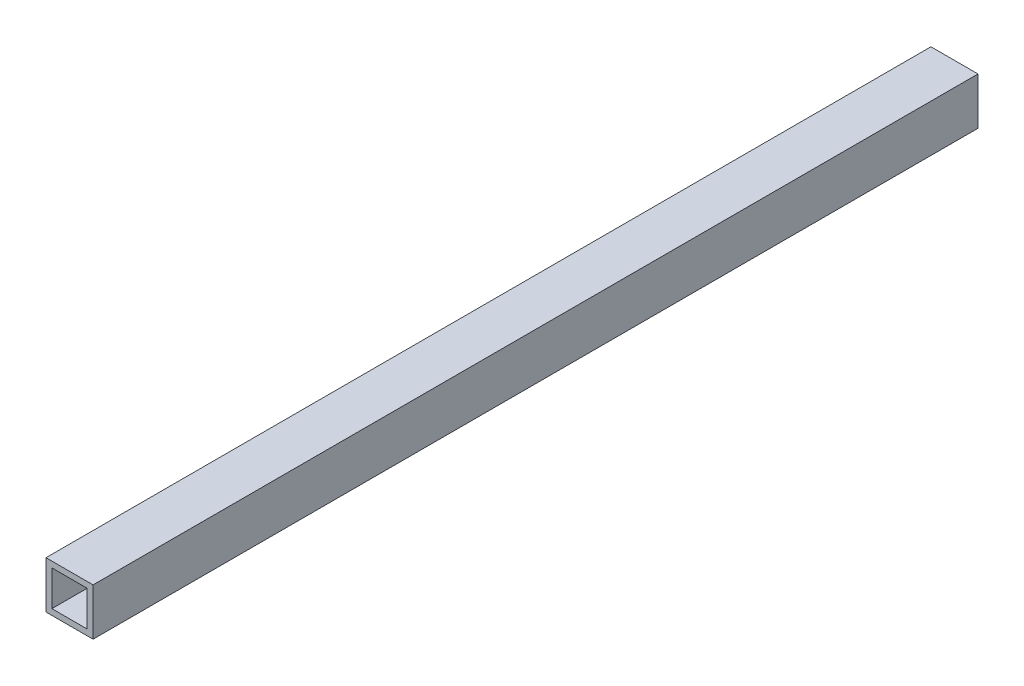
from build123d import *

# Parameters (mm, degrees)
BOSS_EXTRUDE1_DEPTH      = 238.76
BOSS_EXTRUDE1_DEPTH_BACK = 238.76
SKETCH3_W                = 25.4
SKETCH3_H                = 25.4
SKETCH3_W_2              = 19.05
SKETCH3_H_2              = 19.05


with BuildPart() as part:
    # Sketch3 → Boss-Extrude1 (new, two sides: drawn at the far end of the back side and taken through both)
    with BuildSketch(Plane.XY.offset(-BOSS_EXTRUDE1_DEPTH_BACK)):
        Rectangle(SKETCH3_W, SKETCH3_H)
        Rectangle(SKETCH3_W_2, SKETCH3_H_2, mode=Mode.SUBTRACT)
    extrude(amount=BOSS_EXTRUDE1_DEPTH + BOSS_EXTRUDE1_DEPTH_BACK)


solid = part.part
